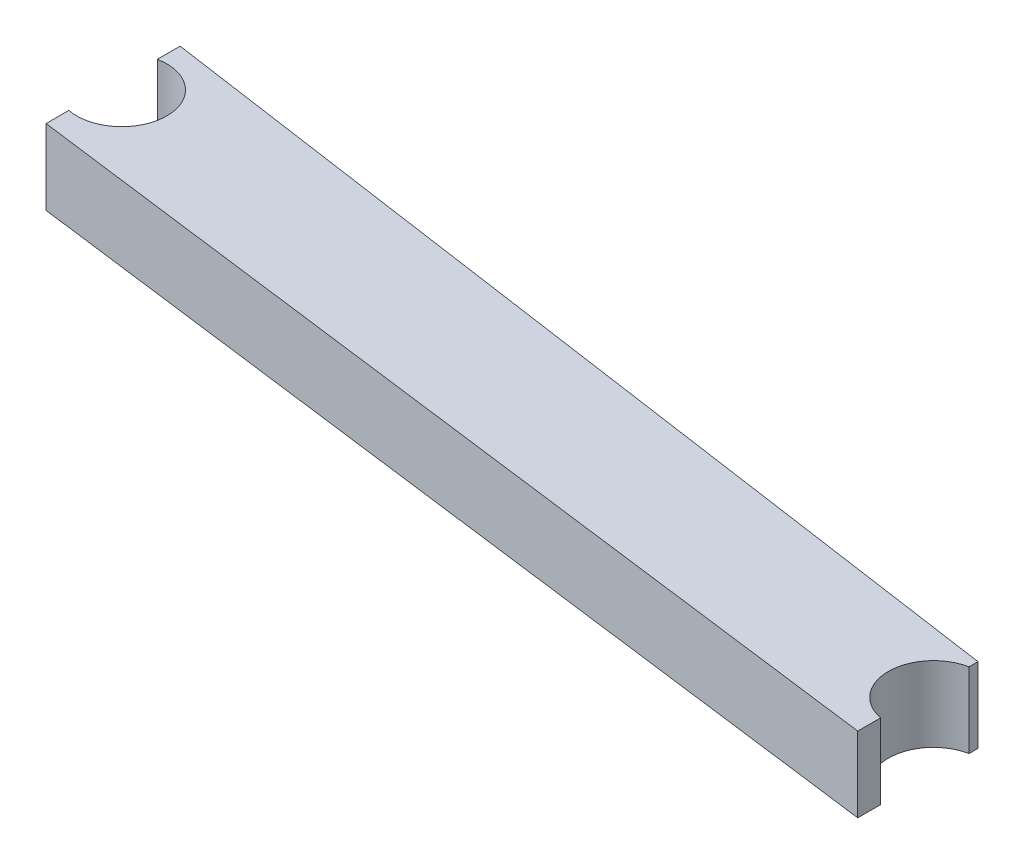
from build123d import *

# Parameters (mm, degrees)
EXTRUDE_START       = 5
EXTRUDE_1_DEPTH     = 5
SKETCH_2_R          = 3
CUT_EXTRUDE_2_DEPTH = 105.040703573


with BuildPart() as part:
    # 草图1 → 凸台-拉伸1 (new body)
    with BuildSketch(Plane(origin=(0, 0, 0), x_dir=(1, 0, 0), z_dir=(0, 1, 0)).offset(EXTRUDE_START)):
        Polygon((17.42, -58.46), (79.42, -66.46), (79.42, -58.46), (17.42, -49.54), align=None)
    extrude(amount=EXTRUDE_1_DEPTH)

    # 草图2 → 切除-拉伸2 (cut, through all)
    with BuildSketch(Plane(origin=(0, 0, 0), x_dir=(1, 0, 0), z_dir=(0, 1, 0))):
        with Locations((18, -54)):
            Circle(SKETCH_2_R)
        with Locations((80, -62)):
            Circle(SKETCH_2_R)
    extrude(amount=CUT_EXTRUDE_2_DEPTH, mode=Mode.SUBTRACT)


solid = part.part
